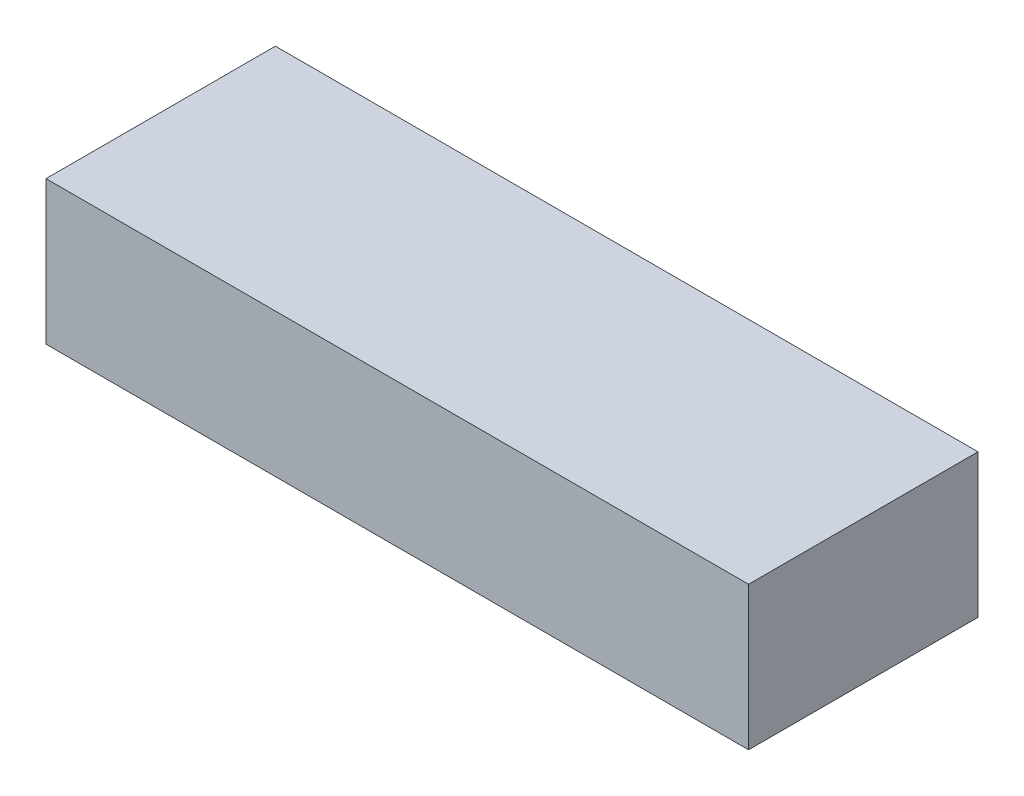
from build123d import *

# Parameters (mm, degrees)
SKETCH1_W           = 49
SKETCH1_H           = 16
BOSS_EXTRUDE1_DEPTH = 10


with BuildPart() as part:
    # Sketch1 → Boss-Extrude1 (new body)
    with BuildSketch(Plane(origin=(0, 0, 0), x_dir=(1, 0, 0), z_dir=(0, 1, 0))):
        with Locations((24.5, 8)):
            Rectangle(SKETCH1_W, SKETCH1_H)
    extrude(amount=BOSS_EXTRUDE1_DEPTH)


solid = part.part
